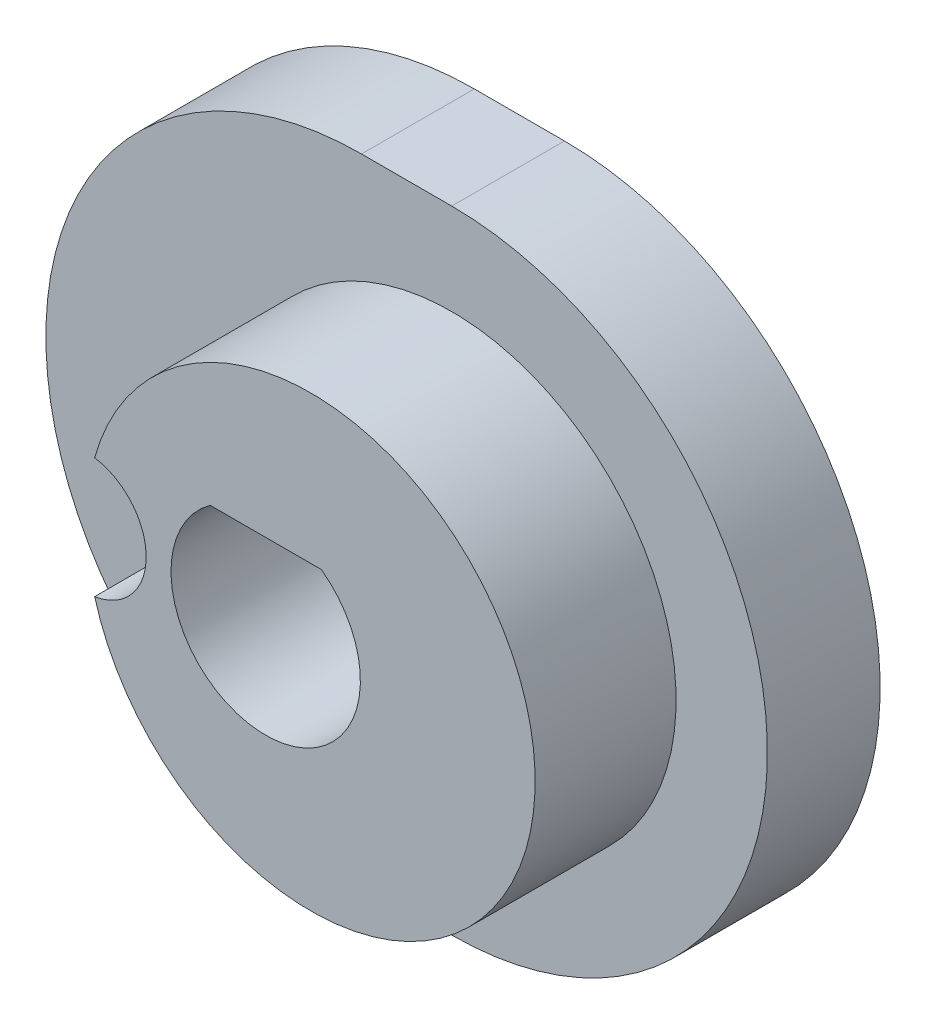
from build123d import *

# Parameters (mm, degrees)
BOSS_EXTRUDE1_DEPTH     = 3.175
SKETCH4_R               = 6.31825
BOSS_EXTRUDE2_DEPTH     = 3.96875
CUT_EXTRUDE1_DEPTH      = 16.014259108
CUT_EXTRUDE1_DEPTH_BACK = 16.014259108
SKETCH2_R               = 0.9
CUT_EXTRUDE2_DEPTH      = 16.014259108
CUT_EXTRUDE2_DEPTH_BACK = 3.81
SKETCH3_R               = 1.7145


with BuildPart() as part:
    # Sketch1 → Boss-Extrude1 (new body)
    with BuildSketch(Plane.XY):
        with BuildLine():
            Line((0, 8.89), (2.54, 8.89))
            ThreePointArc((2.54, 8.89), (11.43, 0), (2.54, -8.89))
            Line((2.54, -8.89), (0, -8.89))
            ThreePointArc((0, -8.89), (-8.89, 0), (0, 8.89))
        make_face()
    extrude(amount=BOSS_EXTRUDE1_DEPTH)

    # Sketch4 → Boss-Extrude2 (add)
    with BuildSketch(Plane.XY.offset(3.175)):
        with Locations((2.54, 0)):
            Circle(SKETCH4_R)
    extrude(amount=BOSS_EXTRUDE2_DEPTH)

    # Sketch2 → Cut-Extrude1 (cut, two sides: drawn at the far end of the back side and taken through both)
    with BuildSketch(Plane.XY.offset(3.175).offset(-CUT_EXTRUDE1_DEPTH_BACK)):
        with Locations((-3.81, 0)):
            Circle(SKETCH2_R)
        with BuildLine():
            Line((2.835761157, 2.159), (-0.295761157, 2.159))
            ThreePointArc((-0.295761157, 2.159), (1.27, -2.667), (2.835761157, 2.159))
        make_face()
    extrude(amount=CUT_EXTRUDE1_DEPTH + CUT_EXTRUDE1_DEPTH_BACK, mode=Mode.SUBTRACT)

    # Sketch3 → Cut-Extrude2 (cut, two sides: drawn at the far end of the back side and taken through both)
    with BuildSketch(Plane.XY.offset(3.175).offset(-CUT_EXTRUDE2_DEPTH_BACK)):
        with Locations(Location((-3.81, 0, 0), (0, 0, 278.828200895))):
            Circle(SKETCH3_R)
    extrude(amount=CUT_EXTRUDE2_DEPTH + CUT_EXTRUDE2_DEPTH_BACK, mode=Mode.SUBTRACT)


solid = part.part
